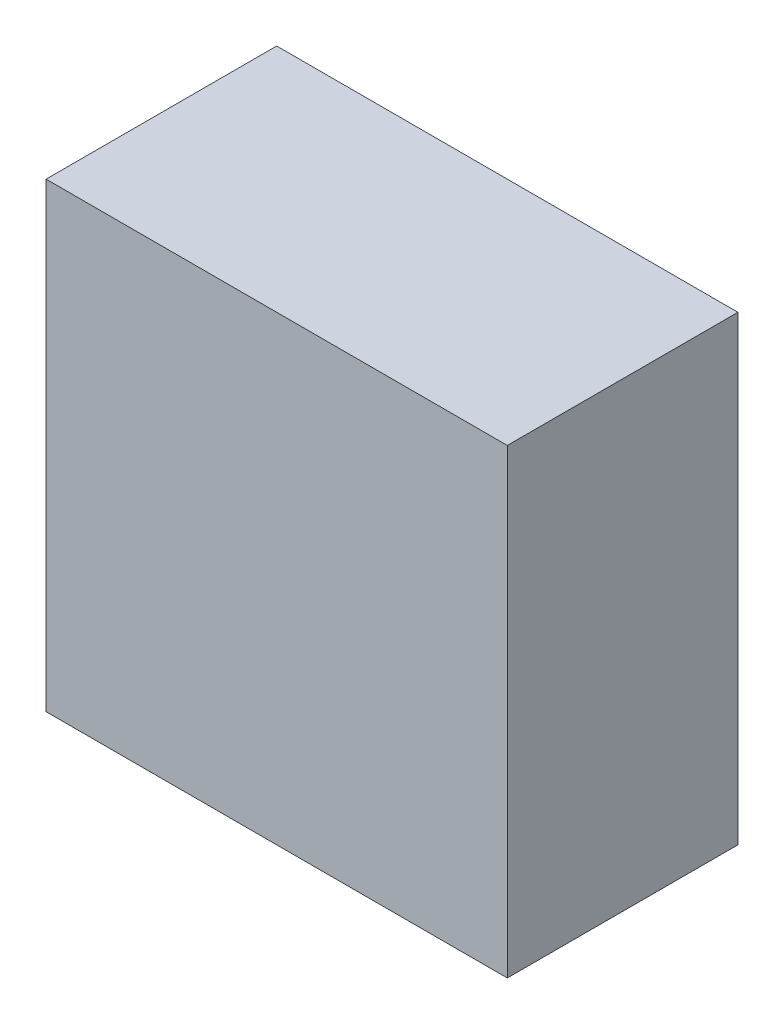
from build123d import *

# Parameters (mm, degrees)
ESQUISSE1_W          = 20
ESQUISSE1_H          = 20
BASE_EXTRUSION_DEPTH = 10


with BuildPart() as part:
    # Esquisse1 → Base-Extrusion (new body)
    with BuildSketch(Plane.XY):
        with Locations((60.044719642, -3.032335741)):
            Rectangle(ESQUISSE1_W, ESQUISSE1_H)
    extrude(amount=BASE_EXTRUSION_DEPTH)


solid = part.part
